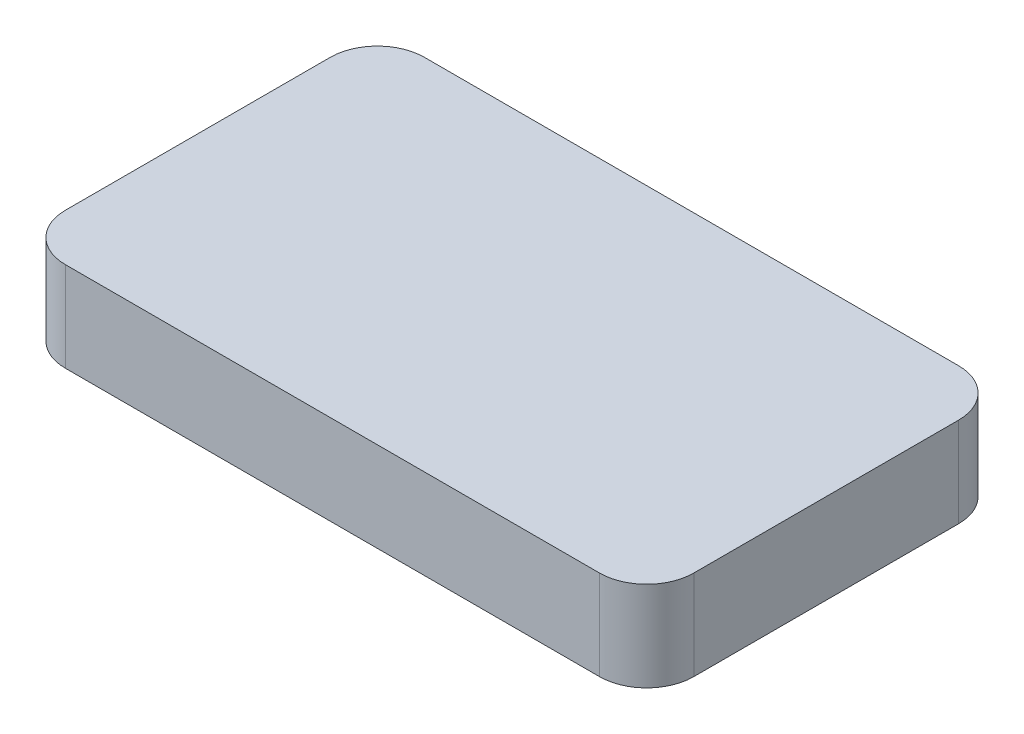
from build123d import *

# Parameters (mm, degrees)
SKETCH1_W           = 266.7
SKETCH1_H           = 152.4
BOSS_EXTRUDE1_DEPTH = 38.1
FILLET1_R           = 20


with BuildPart() as part:
    # Sketch1 → Boss-Extrude1 (new body)
    with BuildSketch(Plane(origin=(0, 0, 0), x_dir=(1, 0, 0), z_dir=(0, 1, 0))):
        Rectangle(SKETCH1_W, SKETCH1_H)
    extrude(amount=BOSS_EXTRUDE1_DEPTH)

    # Fillet1
    fillet1_edges = [part.edges().sort_by_distance(p)[0] for p in [
        (-133.35, 19.05, -76.2),
        (133.35, 19.05, -76.2),
        (133.35, 19.05, 76.2),
        (-133.35, 19.05, 76.2),
    ]]
    fillet(fillet1_edges, radius=FILLET1_R)


solid = part.part
